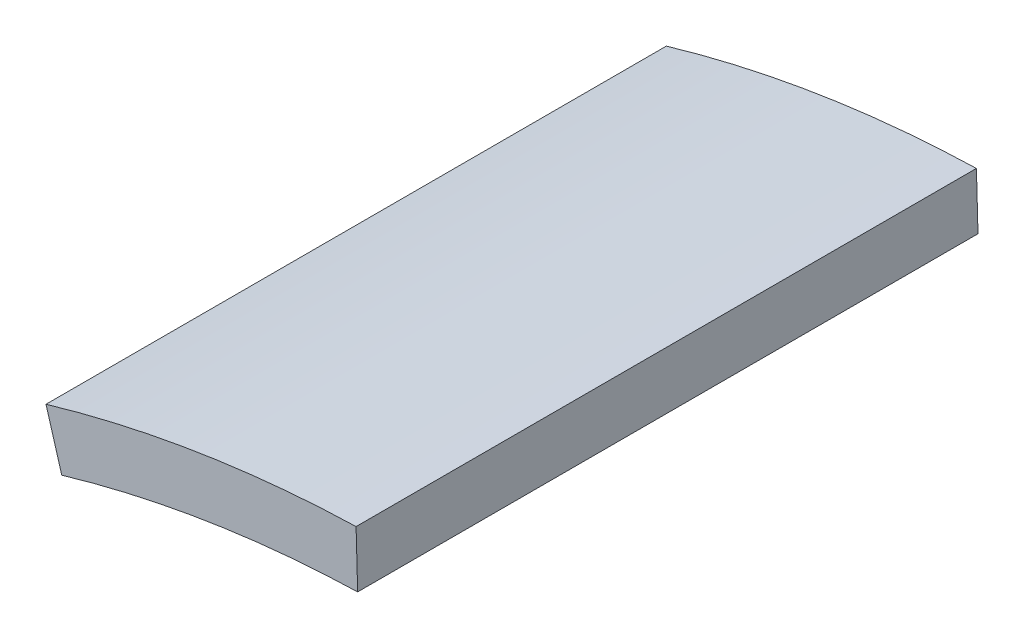
from build123d import *

# Parameters (mm, degrees)
Y_KSEKLIK_EKSTR_ZYON1_DEPTH = 100


with BuildPart() as part:
    # Model → Yükseklik-Ekstrüzyon1 (new body)
    with BuildSketch(Plane.XY):
        with BuildLine():
            Line((-27.777647726, 94.502128478), (-26.508618135, 90.184772354))
            ThreePointArc((-26.508618135, 90.184772354), (-14.704839714, 92.842704016), (-2.657433276, 93.962428919))
            Line((-2.657433276, 93.962428919), (-2.784650827, 98.460630304))
            ThreePointArc((-2.784650827, 98.460630304), (-15.408794806, 97.287301549), (-27.777647726, 94.502128478))
        make_face()
    extrude(amount=Y_KSEKLIK_EKSTR_ZYON1_DEPTH)


with BuildPart() as body_2:
    # Ayır1: the piece on the far side of the plane
    add(part.part)
    split(bisect_by=Plane.XY.offset(50), keep=Keep.BOTTOM)


with BuildPart() as part_1:
    add(part.part)

    # Ayır1
    split(bisect_by=Plane.XY.offset(50), keep=Keep.TOP)


solid = part_1.part
